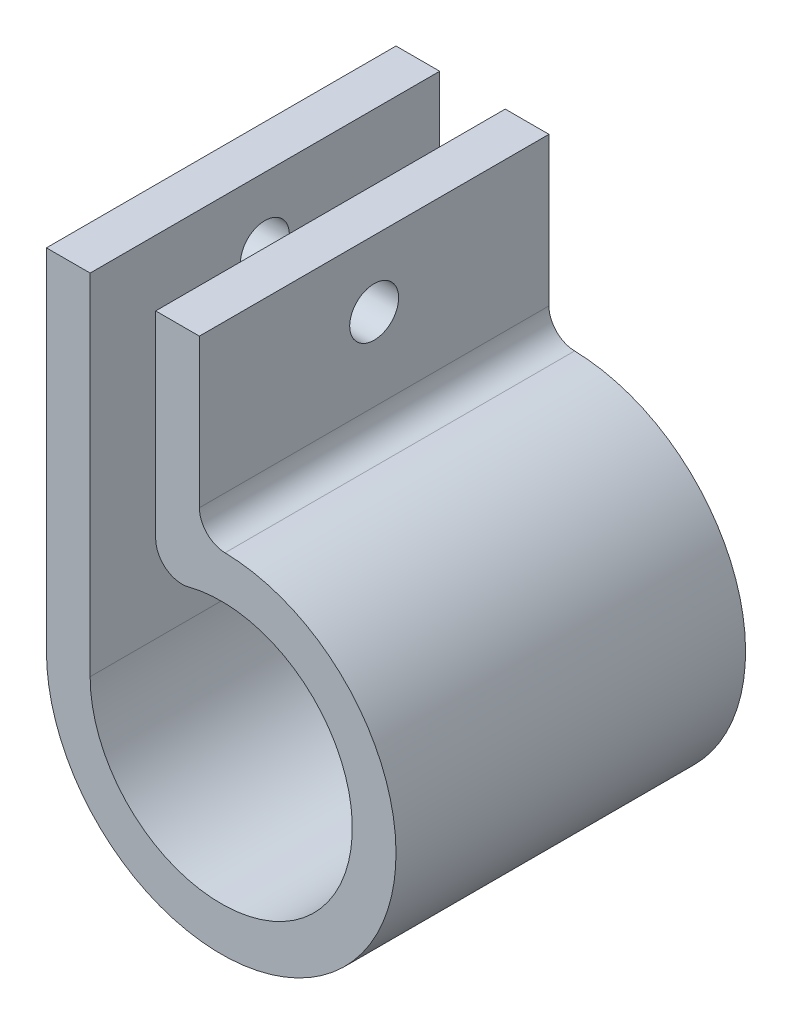
from build123d import *

# Parameters (mm, degrees)
BOSS_EXTRUDE1_DEPTH     = 25.4
FILLET1_R               = 3.81
FILLET2_R               = 3.81
CUT_EXTRUDE1_DEPTH      = 77.2
CUT_EXTRUDE1_DEPTH_BACK = 77.2
SKETCH2_R               = 3.556


with BuildPart() as part:
    # Sketch1 → Boss-Extrude1 (new, symmetric)
    with BuildSketch(Plane.XY):
        with BuildLine():
            Line((-19.05, 50.8), (-25.4, 50.8))
            Line((-25.4, 50.8), (-25.4, 0))
            ThreePointArc((-25.4, 0), (19.05, -16.800520825), (-3.175, 25.200781238))
            Line((-3.175, 25.200781238), (-3.175, 50.8))
            Line((-3.175, 50.8), (-9.525, 50.8))
            Line((-9.525, 50.8), (-9.525, 16.497783942))
            ThreePointArc((-9.525, 16.497783942), (16.497783942, -9.525), (-19.05, 0))
            Line((-19.05, 0), (-19.05, 50.8))
        make_face()
    extrude(amount=BOSS_EXTRUDE1_DEPTH, both=True)

    # Fillet1
    fillet1_edges = [part.edges().sort_by_distance(p)[0] for p in [
        (-9.525, 16.497783942, 0),
    ]]
    fillet(fillet1_edges, radius=FILLET1_R)

    # Fillet2
    fillet2_edges = [part.edges().sort_by_distance(p)[0] for p in [
        (-3.175, 25.200781238, 0),
    ]]
    fillet(fillet2_edges, radius=FILLET2_R)

    # Sketch2 → Cut-Extrude1 (cut, two sides: drawn at the far end of the back side and taken through both)
    with BuildSketch(Plane.ZY.offset(25.4).offset(-CUT_EXTRUDE1_DEPTH_BACK)):
        with Locations(Location((0, 41.148, 0), (0, 0, 270))):
            Circle(SKETCH2_R)
    extrude(amount=CUT_EXTRUDE1_DEPTH + CUT_EXTRUDE1_DEPTH_BACK, mode=Mode.SUBTRACT)


solid = part.part
